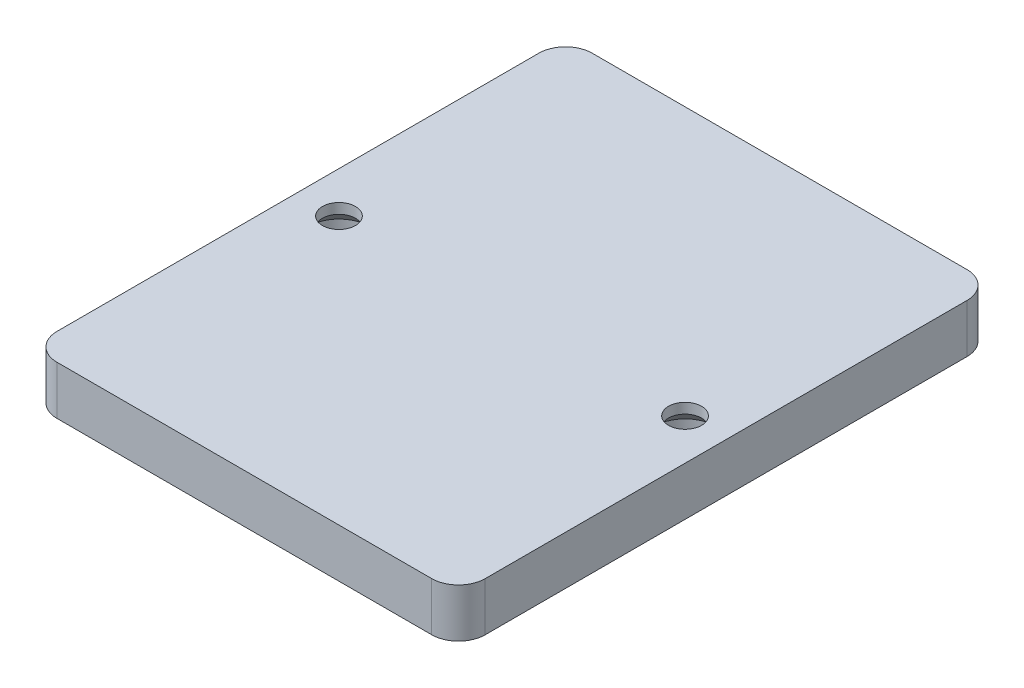
from build123d import *

# Parameters (mm, degrees)
SKETCH1_R                                       = 1.5
BOSS_EXTRUDE1_DEPTH                             = 2.5
CSK_FOR_M3_FLAT_HEAD_MACHINE_SCREW1_D           = 3.4
CSK_FOR_M3_FLAT_HEAD_MACHINE_SCREW1_DEPTH       = 10
CSK_FOR_M3_FLAT_HEAD_MACHINE_SCREW1_CSINK_D     = 6.3
CSK_FOR_M3_FLAT_HEAD_MACHINE_SCREW1_CSINK_ANGLE = 90
CSK_FOR_M3_FLAT_HEAD_MACHINE_SCREW1_TIP         = 1.021463052
BOSS_EXTRUDE2_START                             = 2.5
SKETCH4_R                                       = 3.45
BOSS_EXTRUDE2_DEPTH                             = 2.5


with BuildPart() as part:
    # Sketch1 → Boss-Extrude1 (new body)
    with BuildSketch(Plane(origin=(0, 0, 0), x_dir=(1, 0, 0), z_dir=(0, 1, 0))):
        with BuildLine():
            Line((-19.25, -27.5), (19.25, -27.5))
            ThreePointArc((19.25, -27.5), (21.194543648, -26.694543648), (22, -24.75))
            Line((22, -24.75), (22, 24.75))
            ThreePointArc((22, 24.75), (21.194543648, 26.694543648), (19.25, 27.5))
            Line((19.25, 27.5), (-19.25, 27.5))
            ThreePointArc((-19.25, 27.5), (-21.194543648, 26.694543648), (-22, 24.75))
            Line((-22, 24.75), (-22, -24.75))
            ThreePointArc((-22, -24.75), (-21.194543648, -26.694543648), (-19.25, -27.5))
        make_face()
        with Locations(Location((-17.78, 0, 0), (0, 0, 270))):
            Circle(SKETCH1_R, mode=Mode.SUBTRACT)
        with Locations(Location((17.78, 0, 0), (0, 0, 90))):
            Circle(SKETCH1_R, mode=Mode.SUBTRACT)
    extrude(amount=BOSS_EXTRUDE1_DEPTH)

    # CSK for M3 Flat Head Machine Screw1
    with Locations(Plane(origin=(0, 0, 0), x_dir=(-1, 0, 0), z_dir=(0, -1, 0))):
        with Locations((-17.78, 0), (17.78, 0)):
            CounterSinkHole(CSK_FOR_M3_FLAT_HEAD_MACHINE_SCREW1_D / 2, CSK_FOR_M3_FLAT_HEAD_MACHINE_SCREW1_CSINK_D / 2, depth=CSK_FOR_M3_FLAT_HEAD_MACHINE_SCREW1_DEPTH, counter_sink_angle=CSK_FOR_M3_FLAT_HEAD_MACHINE_SCREW1_CSINK_ANGLE)
            with Locations((0, 0, -(CSK_FOR_M3_FLAT_HEAD_MACHINE_SCREW1_DEPTH + CSK_FOR_M3_FLAT_HEAD_MACHINE_SCREW1_TIP / 2))):  # 118° drill point
                Cone(0, CSK_FOR_M3_FLAT_HEAD_MACHINE_SCREW1_D / 2, CSK_FOR_M3_FLAT_HEAD_MACHINE_SCREW1_TIP, mode=Mode.SUBTRACT)

    # Sketch4 → Boss-Extrude2 (add)
    with BuildSketch(Plane.XZ.offset(BOSS_EXTRUDE2_START)):
        with BuildLine():
            Line((-22, 24.75), (-22, -24.75))
            ThreePointArc((-22, -24.75), (-21.194543648, -26.694543648), (-19.25, -27.5))
            Line((-19.25, -27.5), (19.25, -27.5))
            ThreePointArc((19.25, -27.5), (21.194543648, -26.694543648), (22, -24.75))
            Line((22, -24.75), (22, 24.75))
            ThreePointArc((22, 24.75), (21.194543648, 26.694543648), (19.25, 27.5))
            Line((19.25, 27.5), (-19.25, 27.5))
            ThreePointArc((-19.25, 27.5), (-21.194543648, 26.694543648), (-22, 24.75))
        make_face()
        with Locations(Location((-17.78, 0, 0), (0, 0, 270))):
            Circle(SKETCH4_R, mode=Mode.SUBTRACT)
        with Locations(Location((17.78, 0, 0), (0, 0, 270))):
            Circle(SKETCH4_R, mode=Mode.SUBTRACT)
    extrude(amount=-BOSS_EXTRUDE2_DEPTH)


solid = part.part
